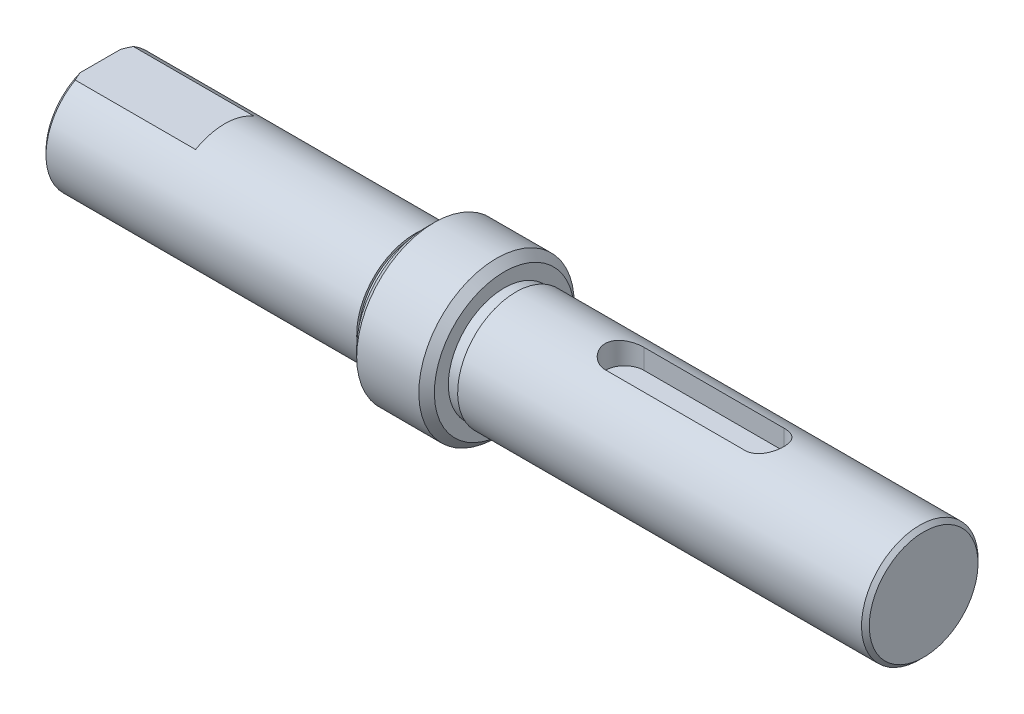
from build123d import *

# Parameters (mm, degrees)
CUT_EXTRUDE_1_DEPTH      = 107.939235082
CUT_EXTRUDE_1_DEPTH_BACK = 107.939235082
SKETCH_3_W               = 16
SKETCH_3_H               = 3.5
CUT_EXTRUDE_START        = 4.5
CUT_EXTRUDE_2_DEPTH      = 103.439235082
M5X0_8_1_D               = 4.2
M5X0_8_1_DEPTH           = 14
M5X0_8_1_CBORE_D         = 5
M5X0_8_1_CBORE_DEPTH     = 10
M5X0_8_1_TIP             = 1.2618073
CHAMFER_1_SIZE           = 1
CHAMFER_2_SIZE           = 0.5


with BuildPart() as part:
    # ｽｹｯﾁ5 → 回転1 (revolve)
    with BuildSketch(Plane.XY):
        Polygon((0, 0), (0, 7.5), (40.5, 7.5), (40.5, 7.2), (42, 7.2), (42, 10), (52, 10), (52, 7.2), (53.5, 7.2), (53.5, 7.5), (106, 7.5), (106, 0), align=None)
    revolve(axis=Axis((0, 0, 0), (-1, 0, 0)))

    # ｽｹｯﾁ3 → ｶｯﾄ - 押し出し1 (cut, two sides: drawn at the far end of the back side and taken through both)
    with BuildSketch(Plane.XY.offset(-CUT_EXTRUDE_1_DEPTH_BACK)):
        with Locations((8, 8.25)):
            Rectangle(SKETCH_3_W, SKETCH_3_H)
        with Locations((8, -8.25)):
            Rectangle(SKETCH_3_W, SKETCH_3_H)
    extrude(amount=CUT_EXTRUDE_1_DEPTH + CUT_EXTRUDE_1_DEPTH_BACK, mode=Mode.SUBTRACT)

    # ｽｹｯﾁ4 → ｶｯﾄ - 押し出し2 (cut, through all)
    with BuildSketch(Plane(origin=(0, 0, 0), x_dir=(1, 0, 0), z_dir=(0, 1, 0)).offset(CUT_EXTRUDE_START)):
        with BuildLine():
            Line((67.5, 2.5), (85.5, 2.5))
            ThreePointArc((85.5, 2.5), (88, 0), (85.5, -2.5))
            Line((85.5, -2.5), (67.5, -2.5))
            ThreePointArc((67.5, -2.5), (65, 0), (67.5, 2.5))
        make_face()
    extrude(amount=CUT_EXTRUDE_2_DEPTH, mode=Mode.SUBTRACT)

    # M5x0.8 ねじ穴1
    with Locations(Plane(origin=(0, 0, 0), x_dir=(0, -1, 0), z_dir=(-1, 0, 0))):
        with Locations((0, 0)):
            CounterBoreHole(M5X0_8_1_D / 2, M5X0_8_1_CBORE_D / 2, M5X0_8_1_CBORE_DEPTH, depth=M5X0_8_1_DEPTH)
            with Locations((0, 0, -(M5X0_8_1_DEPTH + M5X0_8_1_TIP / 2))):  # 118° drill point
                Cone(0, M5X0_8_1_D / 2, M5X0_8_1_TIP, mode=Mode.SUBTRACT)

    # 面取り1
    chamfer_1_edges = [part.edges().sort_by_distance(p)[0] for p in [
        (52, -10, 0),
        (42, -10, 0),
    ]]
    chamfer(chamfer_1_edges, length=CHAMFER_1_SIZE)

    # 面取り2
    chamfer_2_edges = [part.edges().sort_by_distance(p)[0] for p in [
        (0, 0, 7.5),
        (0, 0, -7.5),
        (106, -7.5, 0),
    ]]
    chamfer(chamfer_2_edges, length=CHAMFER_2_SIZE)


solid = part.part
